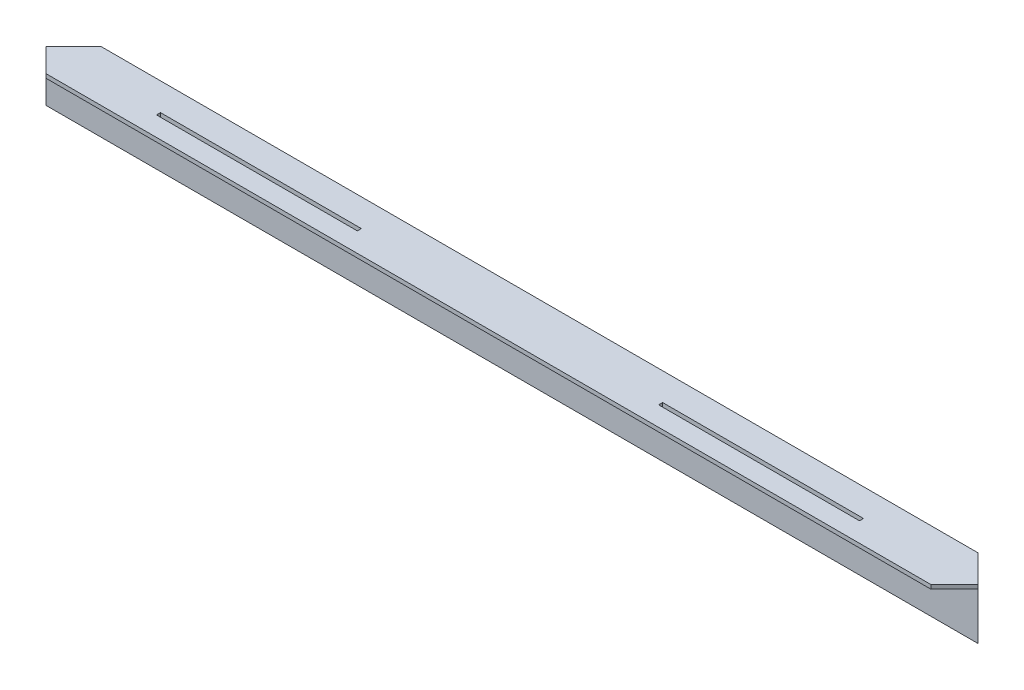
from build123d import *

# Parameters (mm, degrees)
RESSALTO_EXTRUS_O1_DEPTH = 232
CORTE_EXTRUS_O1_DEPTH    = 50
ESBO_O3_W                = 100
ESBO_O3_H                = 2
CORTE_EXTRUS_O2_DEPTH    = 304.296636974
CORTE_EXTRUS_O3_DEPTH    = 50


with BuildPart() as part:
    # Esboço1 → Ressalto-extrusão1 (new, symmetric)
    with BuildSketch(Plane(origin=(0, 0, 0), x_dir=(0, 0, -1), z_dir=(1, 0, 0))):
        Polygon((-193.7, 0), (-168.3, 0), (-168.3, -2), (-180, -2), (-180, -25.4), (-182, -25.4), (-182, -2), (-193.7, -2), align=None)
    extrude(amount=RESSALTO_EXTRUS_O1_DEPTH, both=True)

    # Esboço2 → Corte-extrusão1 (cut, symmetric)
    with BuildSketch(Plane(origin=(0, 0, 0), x_dir=(1, 0, 0), z_dir=(0, 1, 0))):
        Polygon((-232, -182), (-218.3, -168.3), (-232, -168.3), align=None)
        Polygon((232, -182), (218.3, -168.3), (232, -168.3), align=None)
    extrude(amount=CORTE_EXTRUS_O1_DEPTH, both=True, mode=Mode.SUBTRACT)

    # Esboço3 → Corte-extrusão2 (cut, through all)
    with BuildSketch(Plane(origin=(0, 0, 0), x_dir=(1, 0, 0), z_dir=(0, 1, 0))):
        with Locations((-125, -183)):
            Rectangle(ESBO_O3_W, ESBO_O3_H)
        with Locations((125, -183)):
            Rectangle(ESBO_O3_W, ESBO_O3_H)
    extrude(amount=-CORTE_EXTRUS_O2_DEPTH, mode=Mode.SUBTRACT)

    # Esboço4 → Corte-extrusão3 (cut, symmetric)
    with BuildSketch(Plane(origin=(0, 0, 0), x_dir=(1, 0, 0), z_dir=(0, 1, 0))):
        Polygon((-232, -182), (-220.3, -193.7), (-232, -193.7), align=None)
        Polygon((232, -182), (220.3, -193.7), (232, -193.7), align=None)
    extrude(amount=CORTE_EXTRUS_O3_DEPTH, both=True, mode=Mode.SUBTRACT)


solid = part.part
